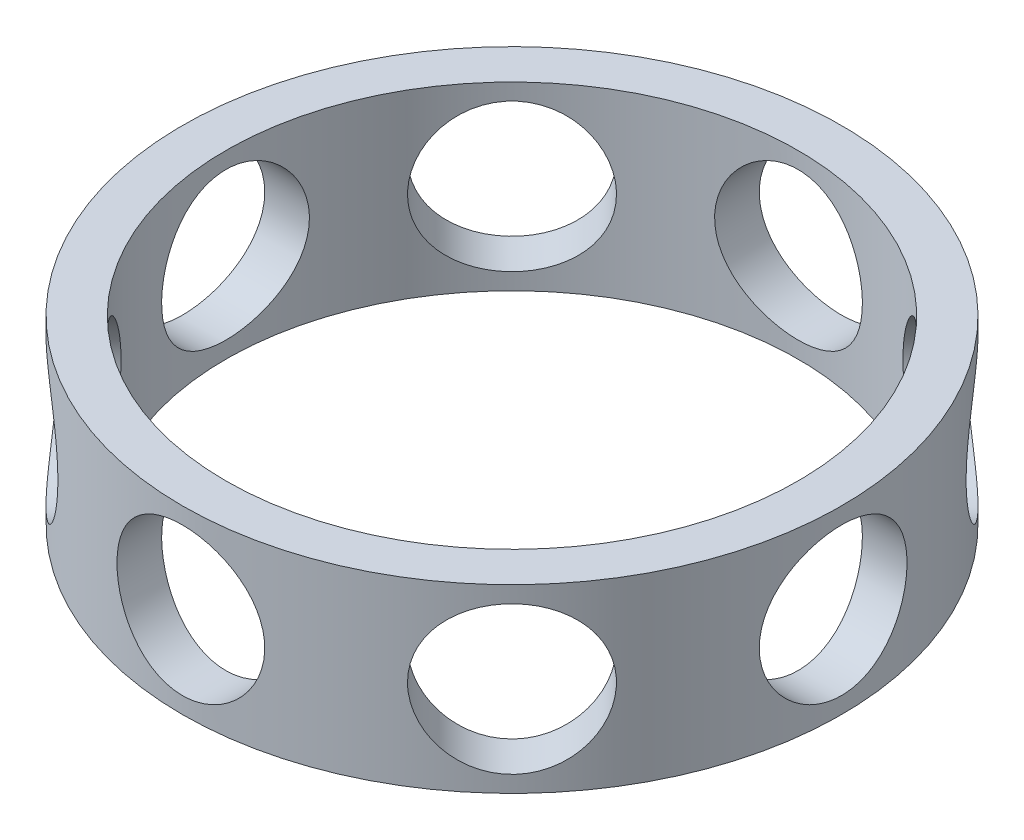
from build123d import *

# Parameters (mm, degrees)
BOSS_EXTRUDE1_DEPTH      = 0.93218
BOSS_EXTRUDE1_DEPTH_BACK = 0.93218
SKETCH1_R                = 3.39852
SKETCH1_R_2              = 2.95148
CUT_EXTRUDE1_REACH       = 6.896
CUT_EXTRUDE1_END_RADIUS  = 3.39852
SKETCH3_R                = 0.762
CIRPATTERN1_COUNT        = 8


with BuildPart() as part:
    # Sketch1 → Boss-Extrude1 (new, two sides: drawn at the far end of the back side and taken through both)
    with BuildSketch(Plane(origin=(0, 0, 0), x_dir=(1, 0, 0), z_dir=(0, 1, 0)).offset(-BOSS_EXTRUDE1_DEPTH_BACK)):
        with Locations(Location((0, 0, 0), (0, 0, 270))):
            Circle(SKETCH1_R)
        with Locations(Location((0, 0, 0), (0, 0, 270))):
            Circle(SKETCH1_R_2, mode=Mode.SUBTRACT)
    extrude(amount=BOSS_EXTRUDE1_DEPTH + BOSS_EXTRUDE1_DEPTH_BACK)

    # Cut-Extrude1: up to this cylinder (the profile starts inside it)
    cut_extrude1_end = Plane(origin=(0, 0, 0), z_dir=(0, 1, 0)) * Cylinder(CUT_EXTRUDE1_END_RADIUS, 21.58904, mode=Mode.PRIVATE)
    # Sketch3 → Cut-Extrude1 (cut, up to the surface)
    with BuildSketch(Plane.XY, mode=Mode.PRIVATE) as cut_extrude1_sk1:
        Circle(SKETCH3_R)
    cut_extrude1_tool1 = extrude(cut_extrude1_sk1.sketch, amount=-CUT_EXTRUDE1_REACH, mode=Mode.PRIVATE) & cut_extrude1_end
    cut_extrude1 = cut_extrude1_tool1.solids().sort_by_distance((0, 0, 0))[0]
    add(cut_extrude1, mode=Mode.SUBTRACT)

    # CirPattern1: Cut-Extrude1 ×8 about axis
    cirpattern1_axis = Axis((0, 0, 0), (0, 1, 0))
    for i in range(1, CIRPATTERN1_COUNT):
        add(cut_extrude1.rotate(cirpattern1_axis, i * 360 / CIRPATTERN1_COUNT), mode=Mode.SUBTRACT)


solid = part.part
